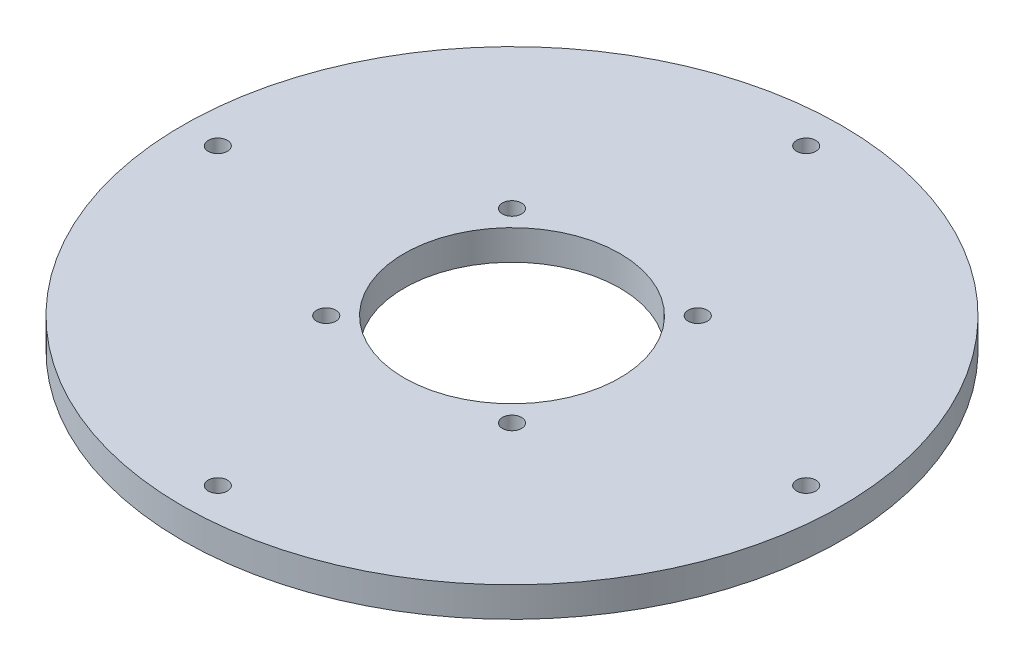
from build123d import *

# Parameters (mm, degrees)
SKETCH_2_W          = 46
SKETCH_2_H          = 46
SKETCH_2_R          = 18
EXTRUDE_1_DEPTH     = 5
FILLET_1_R          = 5.5
SKETCH_3_R          = 1.6
CUT_EXTRUDE_1_DEPTH = 33.908965344
SKETCH_4_R          = 55
SKETCH_4_R_2        = 1.6
SKETCH_4_R_3        = 18
EXTRUDE_2_DEPTH     = 5


with BuildPart() as part:
    # 草图2 → 凸台-拉伸1 (new body)
    with BuildSketch(Plane(origin=(0, 0, 0), x_dir=(1, 0, 0), z_dir=(0, 1, 0))):
        Rectangle(SKETCH_2_W, SKETCH_2_H)
        with Locations(Location((0, 0, 0), (0, 0, 270))):
            Circle(SKETCH_2_R, mode=Mode.SUBTRACT)
    extrude(amount=EXTRUDE_1_DEPTH)

    # 圆角1
    fillet_1_edges = [part.edges().sort_by_distance(p)[0] for p in [
        (23, 2.5, 23),
        (-23, 2.5, 23),
        (-23, 2.5, -23),
        (23, 2.5, -23),
    ]]
    fillet(fillet_1_edges, radius=FILLET_1_R)

    # 草图3 → 切除-拉伸1 (cut, through all)
    with BuildSketch(Plane(origin=(0, 5, 0), x_dir=(1, 0, 0), z_dir=(0, 1, 0))):
        with Locations(Location((-15.5, 15.5, 0), (0, 0, 270))):
            Circle(SKETCH_3_R)
        with Locations(Location((15.5, 15.5, 0), (0, 0, 270))):
            Circle(SKETCH_3_R)
        with Locations(Location((-15.5, -15.5, 0), (0, 0, 270))):
            Circle(SKETCH_3_R)
        with Locations(Location((15.5, -15.5, 0), (0, 0, 270))):
            Circle(SKETCH_3_R)
    extrude(amount=-CUT_EXTRUDE_1_DEPTH, mode=Mode.SUBTRACT)

    # 草图4 → 凸台-拉伸2 (add)
    # profile 1 of 2: a face of its own
    with BuildSketch(Plane(origin=(0, 5, 0), x_dir=(1, 0, 0), z_dir=(0, 1, 0))):
        with Locations(Location((0, 0, 0), (0, 0, 270))):
            Circle(SKETCH_4_R)
        with Locations(Location((-49.1, 0, 0), (0, 0, 270))):
            Circle(SKETCH_4_R_2, mode=Mode.SUBTRACT)
        with Locations(Location((0, -49.1, 0), (0, 0, 270))):
            Circle(SKETCH_4_R_2, mode=Mode.SUBTRACT)
        with Locations(Location((49.1, 0, 0), (0, 0, 270))):
            Circle(SKETCH_4_R_2, mode=Mode.SUBTRACT)
        with Locations(Location((0, 49.1, 0), (0, 0, 270))):
            Circle(SKETCH_4_R_2, mode=Mode.SUBTRACT)
        with BuildLine():
            Line((-17.5, -23), (17.5, -23))
            ThreePointArc((17.5, -23), (21.389087297, -21.389087297), (23, -17.5))
            Line((23, -17.5), (23, 17.5))
            ThreePointArc((23, 17.5), (21.389087297, 21.389087297), (17.5, 23))
            Line((17.5, 23), (-17.5, 23))
            ThreePointArc((-17.5, 23), (-21.389087297, 21.389087297), (-23, 17.5))
            Line((-23, 17.5), (-23, -17.5))
            ThreePointArc((-23, -17.5), (-21.389087297, -21.389087297), (-17.5, -23))
        make_face(mode=Mode.SUBTRACT)
    # profile 2 of 2: a face of its own
    with BuildSketch(Plane(origin=(0, 5, 0), x_dir=(1, 0, 0), z_dir=(0, 1, 0))):
        with BuildLine():
            ThreePointArc((-23, -17.5), (-21.389087297, -21.389087297), (-17.5, -23))
            Line((-17.5, -23), (17.5, -23))
            ThreePointArc((17.5, -23), (21.389087297, -21.389087297), (23, -17.5))
            Line((23, -17.5), (23, 17.5))
            ThreePointArc((23, 17.5), (21.389087297, 21.389087297), (17.5, 23))
            Line((17.5, 23), (-17.5, 23))
            ThreePointArc((-17.5, 23), (-21.389087297, 21.389087297), (-23, 17.5))
            Line((-23, 17.5), (-23, -17.5))
        make_face()
        with Locations(Location((15.5, 15.5, 0), (0, 0, 270))):
            Circle(SKETCH_4_R_2, mode=Mode.SUBTRACT)
        with Locations(Location((-15.5, -15.5, 0), (0, 0, 270))):
            Circle(SKETCH_4_R_2, mode=Mode.SUBTRACT)
        with Locations(Location((0, 0, 0), (0, 0, 270))):
            Circle(SKETCH_4_R_3, mode=Mode.SUBTRACT)
        with Locations(Location((-15.5, 15.5, 0), (0, 0, 270))):
            Circle(SKETCH_4_R_2, mode=Mode.SUBTRACT)
        with Locations(Location((15.5, -15.5, 0), (0, 0, 270))):
            Circle(SKETCH_4_R_2, mode=Mode.SUBTRACT)
    extrude(amount=-EXTRUDE_2_DEPTH)


solid = part.part
